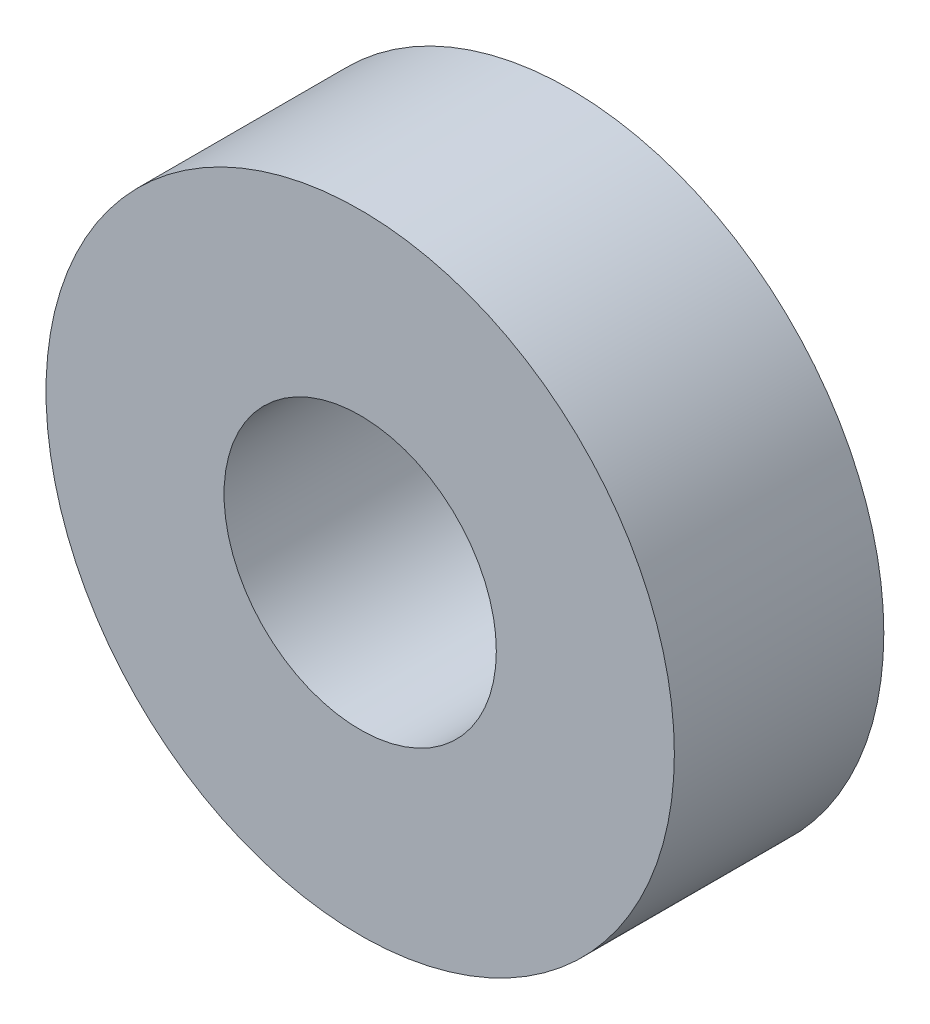
from build123d import *

# Parameters (mm, degrees)
SKETCH2_R           = 7.5
SKETCH2_R_2         = 3.25
BOSS_EXTRUDE1_DEPTH = 5


with BuildPart() as part:
    # Sketch2 → Boss-Extrude1 (new body)
    with BuildSketch(Plane.XY):
        Circle(SKETCH2_R)
        Circle(SKETCH2_R_2, mode=Mode.SUBTRACT)
    extrude(amount=BOSS_EXTRUDE1_DEPTH)


solid = part.part
